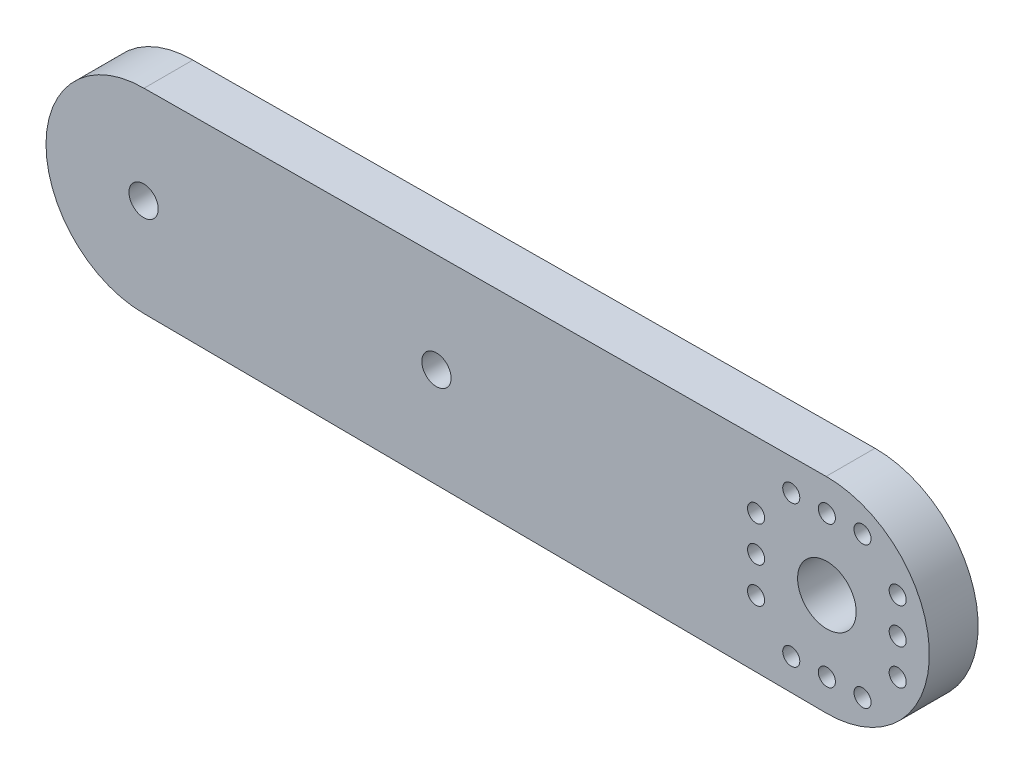
from build123d import *

# Parameters (mm, degrees)
ESQUISSE1_R        = 0.875
ESQUISSE1_R_2      = 1.5
ESQUISSE1_R_3      = 3
BOSS_EXTRU_1_DEPTH = 5


with BuildPart() as part:
    # Esquisse1 → Boss.-Extru.1 (new body)
    with BuildSketch(Plane.XY):
        with BuildLine():
            Line((-70, -10), (-0.075038305, -10.499731866))
            ThreePointArc((-0.075038305, -10.499731866), (10.5, 2.989e-05), (-0.075098083, 10.499731438))
            Line((-0.075098083, 10.499731438), (-69.957164253, 9.999908255))
            ThreePointArc((-69.957164253, 9.999908255), (-79.999977064, 0.021417923), (-70, -10))
        make_face()
        with Locations((7.2545, 3.65)):
            Circle(ESQUISSE1_R, mode=Mode.SUBTRACT)
        with Locations((7.2545, 0)):
            Circle(ESQUISSE1_R, mode=Mode.SUBTRACT)
        with Locations(Location((7.2545, -3.65, 0), (0, 0, 180))):
            Circle(ESQUISSE1_R, mode=Mode.SUBTRACT)
        with Locations((3.65, -7.2545)):
            Circle(ESQUISSE1_R, mode=Mode.SUBTRACT)
        with Locations((0, -7.2545)):
            Circle(ESQUISSE1_R, mode=Mode.SUBTRACT)
        with Locations(Location((-3.65, -7.2545, 0), (0, 0, 180))):
            Circle(ESQUISSE1_R, mode=Mode.SUBTRACT)
        with Locations((-7.2545, -3.65)):
            Circle(ESQUISSE1_R, mode=Mode.SUBTRACT)
        with Locations((-7.2545, 0)):
            Circle(ESQUISSE1_R, mode=Mode.SUBTRACT)
        with Locations(Location((-7.2545, 3.65, 0), (0, 0, 180))):
            Circle(ESQUISSE1_R, mode=Mode.SUBTRACT)
        with Locations((-3.65, 7.2545)):
            Circle(ESQUISSE1_R, mode=Mode.SUBTRACT)
        with Locations((0, 7.2545)):
            Circle(ESQUISSE1_R, mode=Mode.SUBTRACT)
        with Locations(Location((3.65, 7.2545, 0), (0, 0, 180))):
            Circle(ESQUISSE1_R, mode=Mode.SUBTRACT)
        with Locations((-70, 0)):
            Circle(ESQUISSE1_R_2, mode=Mode.SUBTRACT)
        with Locations((-40, 0)):
            Circle(ESQUISSE1_R_2, mode=Mode.SUBTRACT)
        Circle(ESQUISSE1_R_3, mode=Mode.SUBTRACT)
    extrude(amount=BOSS_EXTRU_1_DEPTH)


solid = part.part
